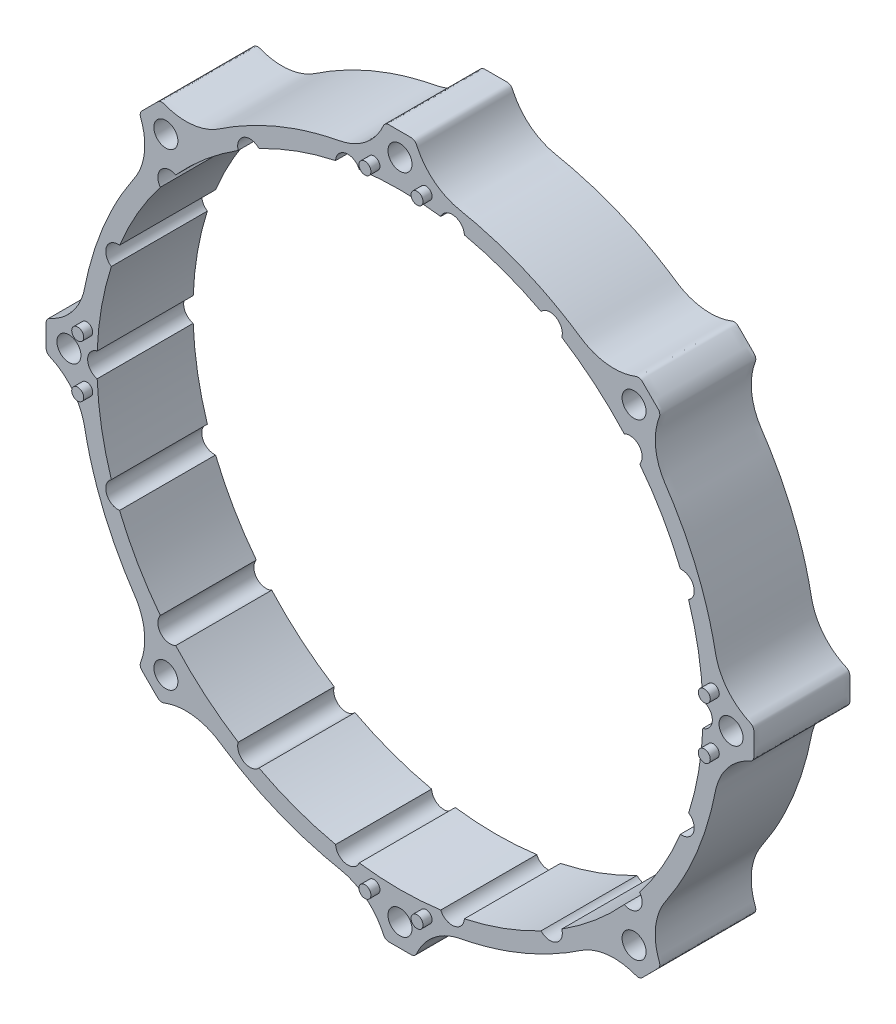
from build123d import *

# Parameters (mm, degrees)
BOSS_EXTRUDE1_DEPTH             = 16
F_4_0MM_DOWEL_HOLE1_D           = 4
F_4_0MM_DOWEL_HOLE1_CSINK_D     = 4.05
F_4_0MM_DOWEL_HOLE1_CSINK_ANGLE = 90
CIRPATTERN1_COUNT               = 8
F_2_0MM_DOWEL_HOLE1_AT_2_COUNT  = 2
F_2_0MM_DOWEL_HOLE1_AT_2_PITCH  = 8.682408883
CIRPATTERN2_COUNT               = 4
SKETCH9_R                       = 1
BOSS_EXTRUDE2_DEPTH             = 1.5
CIRPATTERN3_COUNT               = 4


with BuildPart() as part:
    # Sketch1 → Boss-Extrude1 (new body)
    with BuildSketch(Plane.XY):
        with BuildLine():
            add(Edge.make_bspline(
                [(2.888569338, 58.090305414), (2.86043616, 58.149718786), (2.805341513, 58.269100351), (2.727304111, 58.453248868), (2.652227716, 58.561956296), (2.609742987, 58.612120747), (2.483296792, 58.761423899), (2.319504695, 58.868438946), (2.131986062, 58.924267553), (2.101278346, 58.933409946), (2.038984153, 58.948743127), (1.942760285, 58.965842714), (1.878680735, 58.965842714), (1.84664096, 58.965842714), (1.814601185, 58.965842714), (1.750521635, 58.965842714), (1.654402311, 58.965842714), (1.590322761, 58.965842714), (1.558282986, 58.965842714), (0.519427662, 58.965842714), (-0.519427662, 58.965842714), (-1.558282986, 58.965842714), (-1.590322761, 58.965842714), (-1.654402311, 58.965842714), (-1.750521635, 58.965842714), (-1.814601185, 58.965842714), (-1.84664096, 58.965842714), (-1.878680735, 58.965842714), (-1.942760285, 58.965842714), (-2.038984153, 58.948743127), (-2.101278346, 58.933409946), (-2.131986062, 58.924267553), (-2.319504695, 58.868438946), (-2.483296792, 58.761423899), (-2.609742987, 58.612120747), (-2.652227716, 58.561956296), (-2.727304111, 58.453248868), (-2.805341513, 58.269100351), (-2.86043616, 58.149718786), (-2.888569338, 58.090305414), (-3.904277799, 55.9452699), (-5.591838924, 54.27644442), (-7.748079959, 53.284746062), (-8.235225684, 53.060698004), (-9.245557382, 52.690963884), (-10.84227328, 52.398071486), (-11.889156148, 52.164983222), (-12.410727624, 52.040597997), (-17.936005436, 50.722920633), (-23.183850069, 48.549192213), (-28.022550078, 45.573969403), (-28.479310442, 45.293116312), (-29.384386709, 44.717676629), (-30.720541549, 43.79573419), (-31.696395448, 43.342763299), (-32.199285394, 43.156725154), (-34.52028494, 42.298099023), (-36.994919588, 42.319571853), (-39.300669877, 43.218345087), (-39.301071956, 43.218501816), (-39.301876093, 43.218815326), (-39.303082259, 43.219285695), (-39.303886294, 43.219599465), (-39.304288312, 43.21975635), (-39.304689349, 43.219912852), (-39.305491422, 43.220225856), (-39.306694532, 43.220695362), (-39.307496605, 43.221008367), (-39.307897642, 43.221164869), (-39.310303861, 43.222103881), (-39.31271008, 43.223042894), (-39.3151163, 43.223981906), (-39.315517337, 43.224138408), (-39.31631941, 43.224451412), (-39.317522519, 43.224920919), (-39.318324593, 43.225233923), (-39.318725629, 43.225390425), (-39.319128068, 43.225547474), (-39.319932946, 43.225861573), (-39.321141382, 43.226329852), (-39.321947274, 43.226641342), (-39.32235032, 43.226796825), (-39.599832465, 43.333841276), (-39.896638588, 43.314841774), (-40.158207362, 43.173290965), (-40.186385644, 43.158041979), (-40.241276486, 43.124835529), (-40.32140827, 43.068886213), (-40.366719354, 43.023575129), (-40.389374896, 43.000919586), (-40.412030438, 42.978264044), (-40.457341522, 42.93295296), (-40.525308148, 42.864986334), (-40.570619233, 42.81967525), (-40.593274775, 42.797019708), (-41.327856419, 42.062438063), (-42.062438063, 41.327856419), (-42.797019708, 40.593274775), (-42.81967525, 40.570619233), (-42.864986334, 40.525308148), (-42.93295296, 40.457341522), (-42.978264044, 40.412030438), (-43.000919586, 40.389374896), (-43.023575129, 40.366719354), (-43.068886213, 40.32140827), (-43.124835529, 40.241276486), (-43.158041979, 40.186385644), (-43.173290965, 40.158207362), (-43.314841774, 39.896638588), (-43.333841276, 39.599832465), (-43.226796825, 39.32235032), (-43.226641342, 39.321947274), (-43.226329852, 39.321141382), (-43.225861573, 39.319932946), (-43.225547474, 39.319128068), (-43.225390425, 39.318725629), (-43.225233923, 39.318324593), (-43.224920919, 39.317522519), (-43.224451412, 39.31631941), (-43.224138408, 39.315517337), (-43.223981906, 39.3151163), (-43.223042894, 39.31271008), (-43.222103881, 39.310303861), (-43.221164869, 39.307897642), (-43.221008367, 39.307496605), (-43.220695362, 39.306694532), (-43.220225856, 39.305491422), (-43.219912852, 39.304689349), (-43.21975635, 39.304288312), (-43.219599465, 39.303886294), (-43.219285695, 39.303082259), (-43.218815326, 39.301876093), (-43.218501816, 39.301071956), (-43.218345087, 39.300669877), (-42.319571853, 36.994919588), (-42.298099023, 34.52028494), (-43.156725154, 32.199285394), (-43.342763299, 31.696395448), (-43.79573419, 30.720541549), (-44.717676629, 29.384386709), (-45.293116312, 28.479310442), (-45.573969403, 28.022550078), (-48.549192213, 23.183850069), (-50.722920633, 17.936005436), (-52.040597997, 12.410727624), (-52.164983222, 11.889156148), (-52.398071486, 10.84227328), (-52.690963884, 9.245557382), (-53.060698004, 8.235225684), (-53.284746062, 7.748079959), (-54.31880022, 5.499745081), (-56.083814744, 3.765097724), (-58.349755058, 2.770214708), (-58.350150195, 2.770041219), (-58.350940491, 2.769694293), (-58.35212598, 2.769174006), (-58.352916388, 2.768827336), (-58.353311592, 2.768654001), (-58.353705831, 2.768481089), (-58.35449431, 2.768135265), (-58.355677028, 2.767616529), (-58.356465507, 2.767270705), (-58.356859746, 2.767097793), (-58.359225182, 2.766060321), (-58.361590618, 2.765022849), (-58.363956055, 2.763985377), (-58.364350294, 2.763812465), (-58.365138773, 2.763466641), (-58.366321491, 2.762947905), (-58.367109969, 2.762602081), (-58.367504209, 2.762429169), (-58.367899827, 2.762255652), (-58.368691063, 2.761908619), (-58.36987668, 2.761385249), (-58.370666787, 2.761035654), (-58.371061728, 2.7608606), (-58.642963091, 2.640342951), (-58.839402036, 2.417034653), (-58.924267553, 2.131986062), (-58.933409946, 2.101278346), (-58.948743127, 2.038984153), (-58.965842714, 1.942760285), (-58.965842714, 1.878680735), (-58.965842714, 1.84664096), (-58.965842714, 1.814601185), (-58.965842714, 1.750521635), (-58.965842714, 1.654402311), (-58.965842714, 1.590322761), (-58.965842714, 1.558282986), (-58.965842714, 0.519427662), (-58.965842714, -0.519427662), (-58.965842714, -1.558282986), (-58.965842714, -1.590322761), (-58.965842714, -1.654402311), (-58.965842714, -1.750521635), (-58.965842714, -1.814601185), (-58.965842714, -1.84664096), (-58.965842714, -1.878680735), (-58.965842714, -1.942760285), (-58.948743127, -2.038984153), (-58.933409946, -2.101278346), (-58.924267553, -2.131986062), (-58.839402036, -2.417034653), (-58.642963091, -2.640342951), (-58.371061728, -2.7608606), (-58.370666787, -2.761035654), (-58.36987668, -2.761385249), (-58.368691063, -2.761908619), (-58.367899827, -2.762255652), (-58.367504209, -2.762429169), (-58.367109969, -2.762602081), (-58.366321491, -2.762947905), (-58.365138773, -2.763466641), (-58.364350294, -2.763812465), (-58.363956055, -2.763985377), (-58.361590618, -2.765022849), (-58.359225182, -2.766060321), (-58.356859746, -2.767097793), (-58.356465507, -2.767270705), (-58.355677028, -2.767616529), (-58.35449431, -2.768135265), (-58.353705831, -2.768481089), (-58.353311592, -2.768654001), (-58.352916388, -2.768827336), (-58.35212598, -2.769174006), (-58.350940491, -2.769694293), (-58.350150195, -2.770041219), (-58.349755058, -2.770214708), (-56.083814744, -3.765097724), (-54.31880022, -5.499745081), (-53.284746062, -7.748079959), (-53.060698004, -8.235225684), (-52.690963884, -9.245557382), (-52.398071486, -10.84227328), (-52.164983222, -11.889156148), (-52.040597997, -12.410727624), (-50.722920633, -17.936005436), (-48.549192213, -23.183850069), (-45.573969403, -28.022550078), (-45.293116312, -28.479310442), (-44.717676629, -29.384386709), (-43.79573419, -30.720541549), (-43.342763299, -31.696395448), (-43.156725154, -32.199285394), (-42.298099023, -34.52028494), (-42.319571853, -36.994919588), (-43.218345087, -39.300669877), (-43.218501816, -39.301071956), (-43.218815326, -39.301876093), (-43.219285695, -39.303082259), (-43.219599465, -39.303886294), (-43.21975635, -39.304288312), (-43.219912852, -39.304689349), (-43.220225856, -39.305491422), (-43.220695362, -39.306694532), (-43.221008367, -39.307496605), (-43.221164869, -39.307897642), (-43.222103881, -39.310303861), (-43.223042894, -39.31271008), (-43.223981906, -39.3151163), (-43.224138408, -39.315517337), (-43.224451412, -39.31631941), (-43.224920919, -39.317522519), (-43.225233923, -39.318324593), (-43.225390425, -39.318725629), (-43.225547474, -39.319128068), (-43.225861573, -39.319932946), (-43.226329852, -39.321141382), (-43.226641342, -39.321947274), (-43.226796825, -39.32235032), (-43.333841276, -39.599832465), (-43.314841774, -39.896638588), (-43.173290965, -40.158207362), (-43.158041979, -40.186385644), (-43.124835529, -40.241276486), (-43.068886213, -40.32140827), (-43.023575129, -40.366719354), (-43.000919586, -40.389374896), (-42.978264044, -40.412030438), (-42.93295296, -40.457341522), (-42.864986334, -40.525308148), (-42.81967525, -40.570619233), (-42.797019708, -40.593274775), (-42.062438063, -41.327856419), (-41.327856419, -42.062438063), (-40.593274775, -42.797019708), (-40.570619233, -42.81967525), (-40.525308148, -42.864986334), (-40.457341522, -42.93295296), (-40.412030438, -42.978264044), (-40.389374896, -43.000919586), (-40.366719354, -43.023575129), (-40.32140827, -43.068886213), (-40.241276486, -43.124835529), (-40.186385644, -43.158041979), (-40.158207362, -43.173290965), (-39.896638588, -43.314841774), (-39.599832465, -43.333841276), (-39.32235032, -43.226796825), (-39.321947274, -43.226641342), (-39.321141382, -43.226329852), (-39.319932946, -43.225861573), (-39.319128068, -43.225547474), (-39.318725629, -43.225390425), (-39.318324593, -43.225233923), (-39.317522519, -43.224920919), (-39.31631941, -43.224451412), (-39.315517337, -43.224138408), (-39.3151163, -43.223981906), (-39.31271008, -43.223042894), (-39.310303861, -43.222103881), (-39.307897642, -43.221164869), (-39.307496605, -43.221008367), (-39.306694532, -43.220695362), (-39.305491422, -43.220225856), (-39.304689349, -43.219912852), (-39.304288312, -43.21975635), (-39.303886294, -43.219599465), (-39.303082259, -43.219285695), (-39.301876093, -43.218815326), (-39.301071956, -43.218501816), (-39.300669877, -43.218345087), (-36.994919588, -42.319571853), (-34.52028494, -42.298099023), (-32.199285394, -43.156725154), (-31.696395448, -43.342763299), (-30.720541549, -43.79573419), (-29.384386709, -44.717676629), (-28.479310442, -45.293116312), (-28.022550078, -45.573969403), (-23.183850069, -48.549192213), (-17.936005436, -50.722920633), (-12.410727624, -52.040597997), (-11.889156148, -52.164983222), (-10.84227328, -52.398071486), (-9.245557382, -52.690963884), (-8.235225684, -53.060698004), (-7.748079959, -53.284746062), (-5.499745081, -54.31880022), (-3.765097724, -56.083814744), (-2.770214708, -58.349755058), (-2.770041219, -58.350150195), (-2.769694293, -58.350940491), (-2.769174006, -58.35212598), (-2.768827336, -58.352916388), (-2.768654001, -58.353311592), (-2.768481089, -58.353705831), (-2.768135265, -58.35449431), (-2.767616529, -58.355677028), (-2.767270705, -58.356465507), (-2.767097793, -58.356859746), (-2.766060321, -58.359225182), (-2.765022849, -58.361590618), (-2.763985377, -58.363956055), (-2.763812465, -58.364350294), (-2.763466641, -58.365138773), (-2.762947905, -58.366321491), (-2.762602081, -58.367109969), (-2.762429169, -58.367504209), (-2.762255652, -58.367899827), (-2.761908619, -58.368691063), (-2.761385249, -58.36987668), (-2.761035654, -58.370666787), (-2.7608606, -58.371061728), (-2.640342951, -58.642963091), (-2.417034653, -58.839402036), (-2.131986062, -58.924267553), (-2.101278346, -58.933409946), (-2.038984153, -58.948743127), (-1.942760285, -58.965842714), (-1.878680735, -58.965842714), (-1.84664096, -58.965842714), (-1.814601185, -58.965842714), (-1.750521635, -58.965842714), (-1.654402311, -58.965842714), (-1.590322761, -58.965842714), (-1.558282986, -58.965842714), (-0.519427662, -58.965842714), (0.519427662, -58.965842714), (1.558282986, -58.965842714), (1.590322761, -58.965842714), (1.654402311, -58.965842714), (1.750521635, -58.965842714), (1.814601185, -58.965842714), (1.84664096, -58.965842714), (1.878680735, -58.965842714), (1.942760285, -58.965842714), (2.038984153, -58.948743127), (2.101278346, -58.933409946), (2.131986062, -58.924267553), (2.417034653, -58.839402036), (2.640342951, -58.642963091), (2.7608606, -58.371061728), (2.761035654, -58.370666787), (2.761385249, -58.36987668), (2.761908619, -58.368691063), (2.762255652, -58.367899827), (2.762429169, -58.367504209), (2.762602081, -58.367109969), (2.762947905, -58.366321491), (2.763466641, -58.365138773), (2.763812465, -58.364350294), (2.763985377, -58.363956055), (2.765022849, -58.361590618), (2.766060321, -58.359225182), (2.767097793, -58.356859746), (2.767270705, -58.356465507), (2.767616529, -58.355677028), (2.768135265, -58.35449431), (2.768481089, -58.353705831), (2.768654001, -58.353311592), (2.768827336, -58.352916388), (2.769174006, -58.35212598), (2.769694293, -58.350940491), (2.770041219, -58.350150195), (2.770214708, -58.349755058), (3.765097724, -56.083814744), (5.499745081, -54.31880022), (7.748079959, -53.284746062), (8.235225684, -53.060698004), (9.245557382, -52.690963884), (10.84227328, -52.398071486), (11.889156148, -52.164983222), (12.410727624, -52.040597997), (17.936005436, -50.722920633), (23.183850069, -48.549192213), (28.022550078, -45.573969403), (28.479310442, -45.293116312), (29.384386709, -44.717676629), (30.720541549, -43.79573419), (31.696395448, -43.342763299), (32.199285394, -43.156725154), (34.52028494, -42.298099023), (36.994919588, -42.319571853), (39.300669877, -43.218345087), (39.301071956, -43.218501816), (39.301876093, -43.218815326), (39.303082259, -43.219285695), (39.303886294, -43.219599465), (39.304288312, -43.21975635), (39.304689349, -43.219912852), (39.305491422, -43.220225856), (39.306694532, -43.220695362), (39.307496605, -43.221008367), (39.307897642, -43.221164869), (39.310303861, -43.222103881), (39.31271008, -43.223042894), (39.3151163, -43.223981906), (39.315517337, -43.224138408), (39.31631941, -43.224451412), (39.317522519, -43.224920919), (39.318324593, -43.225233923), (39.318725629, -43.225390425), (39.319128068, -43.225547474), (39.319932946, -43.225861573), (39.321141382, -43.226329852), (39.321947274, -43.226641342), (39.32235032, -43.226796825), (39.599832465, -43.333841276), (39.896638588, -43.314841774), (40.158207362, -43.173290965), (40.186385644, -43.158041979), (40.241276486, -43.124835529), (40.32140827, -43.068886213), (40.366719354, -43.023575129), (40.389374896, -43.000919586), (40.412030438, -42.978264044), (40.457341522, -42.93295296), (40.525308148, -42.864986334), (40.570619233, -42.81967525), (40.593274775, -42.797019708), (41.327856419, -42.062438063), (42.062438063, -41.327856419), (42.797019708, -40.593274775), (42.81967525, -40.570619233), (42.864986334, -40.525308148), (42.93295296, -40.457341522), (42.978264044, -40.412030438), (43.000919586, -40.389374896), (43.023575129, -40.366719354), (43.068886213, -40.32140827), (43.124835529, -40.241276486), (43.158041979, -40.186385644), (43.173290965, -40.158207362), (43.314841774, -39.896638588), (43.333841276, -39.599832465), (43.226796825, -39.32235032), (43.226641342, -39.321947274), (43.226329852, -39.321141382), (43.225861573, -39.319932946), (43.225547474, -39.319128068), (43.225390425, -39.318725629), (43.225233923, -39.318324593), (43.224920919, -39.317522519), (43.224451412, -39.31631941), (43.224138408, -39.315517337), (43.223981906, -39.3151163), (43.223042894, -39.31271008), (43.222103881, -39.310303861), (43.221164869, -39.307897642), (43.221008367, -39.307496605), (43.220695362, -39.306694532), (43.220225856, -39.305491422), (43.219912852, -39.304689349), (43.21975635, -39.304288312), (43.219599465, -39.303886294), (43.219285695, -39.303082259), (43.218815326, -39.301876093), (43.218501816, -39.301071956), (43.218345087, -39.300669877), (42.319571853, -36.994919588), (42.298099023, -34.52028494), (43.156725154, -32.199285394), (43.342763299, -31.696395448), (43.79573419, -30.720541549), (44.717676629, -29.384386709), (45.293116312, -28.479310442), (45.573969403, -28.022550078), (48.549192213, -23.183850069), (50.722920633, -17.936005436), (52.040597997, -12.410727624), (52.164983222, -11.889156148), (52.398071486, -10.84227328), (52.690963884, -9.245557382), (53.060698004, -8.235225684), (53.284746062, -7.748079959), (54.31880022, -5.499745081), (56.083814744, -3.765097724), (58.349755058, -2.770214708), (58.350150195, -2.770041219), (58.350940491, -2.769694293), (58.35212598, -2.769174006), (58.352916388, -2.768827336), (58.353311592, -2.768654001), (58.353705831, -2.768481089), (58.35449431, -2.768135265), (58.355677028, -2.767616529), (58.356465507, -2.767270705), (58.356859746, -2.767097793), (58.359225182, -2.766060321), (58.361590618, -2.765022849), (58.363956055, -2.763985377), (58.364350294, -2.763812465), (58.365138773, -2.763466641), (58.366321491, -2.762947905), (58.367109969, -2.762602081), (58.367504209, -2.762429169), (58.367899827, -2.762255652), (58.368691063, -2.761908619), (58.36987668, -2.761385249), (58.370666787, -2.761035654), (58.371061728, -2.7608606), (58.642963091, -2.640342951), (58.839402036, -2.417034653), (58.924267553, -2.131986062), (58.933409946, -2.101278346), (58.948743127, -2.038984153), (58.965842714, -1.942760285), (58.965842714, -1.878680735), (58.965842714, -1.84664096), (58.965842714, -1.814601185), (58.965842714, -1.750521635), (58.965842714, -1.654402311), (58.965842714, -1.590322761), (58.965842714, -1.558282986), (58.965842714, -0.519427662), (58.965842714, 0.519427662), (58.965842714, 1.558282986), (58.965842714, 1.590322761), (58.965842714, 1.654402311), (58.965842714, 1.750521635), (58.965842714, 1.814601185), (58.965842714, 1.84664096), (58.965842714, 1.878680735), (58.965842714, 1.942760285), (58.948743127, 2.038984153), (58.933409946, 2.101278346), (58.924267553, 2.131986062), (58.839402036, 2.417034653), (58.642963091, 2.640342951), (58.371061728, 2.7608606), (58.370666787, 2.761035654), (58.36987668, 2.761385249), (58.368691063, 2.761908619), (58.367899827, 2.762255652), (58.367504209, 2.762429169), (58.367109969, 2.762602081), (58.366321491, 2.762947905), (58.365138773, 2.763466641), (58.364350294, 2.763812465), (58.363956055, 2.763985377), (58.361590618, 2.765022849), (58.359225182, 2.766060321), (58.356859746, 2.767097793), (58.356465507, 2.767270705), (58.355677028, 2.767616529), (58.35449431, 2.768135265), (58.353705831, 2.768481089), (58.353311592, 2.768654001), (58.352916388, 2.768827336), (58.35212598, 2.769174006), (58.350940491, 2.769694293), (58.350150195, 2.770041219), (58.349755058, 2.770214708), (56.083814744, 3.765097724), (54.31880022, 5.499745081), (53.284746062, 7.748079959), (53.060698004, 8.235225684), (52.690963884, 9.245557382), (52.398071486, 10.84227328), (52.164983222, 11.889156148), (52.040597997, 12.410727624), (50.722920633, 17.936005436), (48.549192213, 23.183850069), (45.573969403, 28.022550078), (45.293116312, 28.479310442), (44.717676629, 29.384386709), (43.79573419, 30.720541549), (43.342763299, 31.696395448), (43.156725154, 32.199285394), (42.298099023, 34.52028494), (42.319571853, 36.994919588), (43.218345087, 39.300669877), (43.218501816, 39.301071956), (43.218815326, 39.301876093), (43.219285695, 39.303082259), (43.219599465, 39.303886294), (43.21975635, 39.304288312), (43.219912852, 39.304689349), (43.220225856, 39.305491422), (43.220695362, 39.306694532), (43.221008367, 39.307496605), (43.221164869, 39.307897642), (43.222103881, 39.310303861), (43.223042894, 39.31271008), (43.223981906, 39.3151163), (43.224138408, 39.315517337), (43.224451412, 39.31631941), (43.224920919, 39.317522519), (43.225233923, 39.318324593), (43.225390425, 39.318725629), (43.225547474, 39.319128068), (43.225861573, 39.319932946), (43.226329852, 39.321141382), (43.226641342, 39.321947274), (43.226796825, 39.32235032), (43.333841276, 39.599832465), (43.314841774, 39.896638588), (43.173290965, 40.158207362), (43.158041979, 40.186385644), (43.124835529, 40.241276486), (43.068886213, 40.32140827), (43.023575129, 40.366719354), (43.000919586, 40.389374896), (42.978264044, 40.412030438), (42.93295296, 40.457341522), (42.864986334, 40.525308148), (42.81967525, 40.570619233), (42.797019708, 40.593274775), (42.062438063, 41.327856419), (41.327856419, 42.062438063), (40.593274775, 42.797019708), (40.570619233, 42.81967525), (40.525308148, 42.864986334), (40.457341522, 42.93295296), (40.412030438, 42.978264044), (40.389374896, 43.000919586), (40.366719354, 43.023575129), (40.32140827, 43.068886213), (40.241276486, 43.124835529), (40.186385644, 43.158041979), (40.158207362, 43.173290965), (39.896638588, 43.314841774), (39.599832465, 43.333841276), (39.32235032, 43.226796825), (39.321947274, 43.226641342), (39.321141382, 43.226329852), (39.319932946, 43.225861573), (39.319128068, 43.225547474), (39.318725629, 43.225390425), (39.318324593, 43.225233923), (39.317522519, 43.224920919), (39.31631941, 43.224451412), (39.315517337, 43.224138408), (39.3151163, 43.223981906), (39.31271008, 43.223042894), (39.310303861, 43.222103881), (39.307897642, 43.221164869), (39.307496605, 43.221008367), (39.306694532, 43.220695362), (39.305491422, 43.220225856), (39.304689349, 43.219912852), (39.304288312, 43.21975635), (39.303886295, 43.219599465), (39.303082259, 43.219285695), (39.301876093, 43.218815326), (39.301071956, 43.218501816), (39.300669877, 43.218345087), (36.994919588, 42.319571853), (34.52028494, 42.298099023), (32.199285394, 43.156725154), (31.696395448, 43.342763299), (30.720541549, 43.79573419), (29.384386709, 44.717676629), (28.479310442, 45.293116312), (28.022550078, 45.573969403), (23.183850069, 48.549192213), (17.936005436, 50.722920633), (12.410727624, 52.040597997), (11.889156148, 52.164983222), (10.84227328, 52.398071486), (9.245557382, 52.690963884), (8.235225684, 53.060698004), (7.748079959, 53.284746062), (5.591838924, 54.27644442), (3.904277799, 55.9452699), (2.888569338, 58.090305414)],
                knots=[0, 0, 0, 0, 0.00052727, 0.001054541, 0.001581811, 0.001581811, 0.001581811, 0.003107616, 0.003107616, 0.003107616, 0.003364602, 0.003621588, 0.003878574, 0.003878574, 0.003878574, 0.00413556, 0.004392546, 0.004649532, 0.004649532, 0.004649532, 0.012982025, 0.012982025, 0.012982025, 0.013239011, 0.013495997, 0.013752983, 0.013752983, 0.013752983, 0.014009968, 0.014266954, 0.01452394, 0.01452394, 0.01452394, 0.016049745, 0.016049745, 0.016049745, 0.016577016, 0.017104286, 0.017631556, 0.017631556, 0.017631556, 0.035903949, 0.035903949, 0.035903949, 0.040204709, 0.044505469, 0.048806229, 0.048806229, 0.048806229, 0.093985258, 0.093985258, 0.093985258, 0.098286018, 0.102586778, 0.106887539, 0.106887539, 0.106887539, 0.125874611, 0.125874611, 0.125874611, 0.125878073, 0.125881534, 0.125884995, 0.125884995, 0.125884995, 0.125888448, 0.125891901, 0.125895354, 0.125895354, 0.125895354, 0.125916072, 0.125916072, 0.125916072, 0.125919524, 0.125922977, 0.12592643, 0.12592643, 0.12592643, 0.125929895, 0.12593336, 0.125936825, 0.125936825, 0.125936825, 0.128176158, 0.128176158, 0.128176158, 0.128433144, 0.12869013, 0.128947116, 0.128947116, 0.128947116, 0.129204102, 0.129461088, 0.129718073, 0.129718073, 0.129718073, 0.138050566, 0.138050566, 0.138050566, 0.138307552, 0.138564538, 0.138821524, 0.138821524, 0.138821524, 0.13907851, 0.139335496, 0.139592482, 0.139592482, 0.139592482, 0.141831815, 0.141831815, 0.141831815, 0.14183528, 0.141838745, 0.14184221, 0.14184221, 0.14184221, 0.141845663, 0.141849116, 0.141852568, 0.141852568, 0.141852568, 0.141873286, 0.141873286, 0.141873286, 0.141876739, 0.141880192, 0.141883645, 0.141883645, 0.141883645, 0.141887106, 0.141890567, 0.141894029, 0.141894029, 0.141894029, 0.160881101, 0.160881101, 0.160881101, 0.165181861, 0.169482622, 0.173783382, 0.173783382, 0.173783382, 0.218962411, 0.218962411, 0.218962411, 0.223263171, 0.227563931, 0.231864691, 0.231864691, 0.231864691, 0.250851764, 0.250851764, 0.250851764, 0.250855225, 0.250858687, 0.250862148, 0.250862148, 0.250862148, 0.250865601, 0.250869054, 0.250872507, 0.250872507, 0.250872507, 0.250893224, 0.250893224, 0.250893224, 0.250896677, 0.25090013, 0.250903583, 0.250903583, 0.250903583, 0.250907048, 0.250910513, 0.250913978, 0.250913978, 0.250913978, 0.253153311, 0.253153311, 0.253153311, 0.253410297, 0.253667282, 0.253924268, 0.253924268, 0.253924268, 0.254181254, 0.25443824, 0.254695226, 0.254695226, 0.254695226, 0.263027719, 0.263027719, 0.263027719, 0.263284705, 0.263541691, 0.263798677, 0.263798677, 0.263798677, 0.264055663, 0.264312649, 0.264569635, 0.264569635, 0.264569635, 0.266808968, 0.266808968, 0.266808968, 0.266812433, 0.266815897, 0.266819362, 0.266819362, 0.266819362, 0.266822815, 0.266826268, 0.266829721, 0.266829721, 0.266829721, 0.266850439, 0.266850439, 0.266850439, 0.266853892, 0.266857344, 0.266860797, 0.266860797, 0.266860797, 0.266864259, 0.26686772, 0.266871181, 0.266871181, 0.266871181, 0.285858254, 0.285858254, 0.285858254, 0.290159014, 0.294459774, 0.298760535, 0.298760535, 0.298760535, 0.343939564, 0.343939564, 0.343939564, 0.348240324, 0.352541084, 0.356841844, 0.356841844, 0.356841844, 0.375828917, 0.375828917, 0.375828917, 0.375832378, 0.375835839, 0.375839301, 0.375839301, 0.375839301, 0.375842754, 0.375846207, 0.37584966, 0.37584966, 0.37584966, 0.375870377, 0.375870377, 0.375870377, 0.37587383, 0.375877283, 0.375880736, 0.375880736, 0.375880736, 0.375884201, 0.375887666, 0.375891131, 0.375891131, 0.375891131, 0.378130463, 0.378130463, 0.378130463, 0.378387449, 0.378644435, 0.378901421, 0.378901421, 0.378901421, 0.379158407, 0.379415393, 0.379672379, 0.379672379, 0.379672379, 0.388004872, 0.388004872, 0.388004872, 0.388261858, 0.388518844, 0.38877583, 0.38877583, 0.38877583, 0.389032816, 0.389289802, 0.389546788, 0.389546788, 0.389546788, 0.39178612, 0.39178612, 0.39178612, 0.391789585, 0.39179305, 0.391796515, 0.391796515, 0.391796515, 0.391799968, 0.391803421, 0.391806874, 0.391806874, 0.391806874, 0.391827591, 0.391827591, 0.391827591, 0.391831044, 0.391834497, 0.39183795, 0.39183795, 0.39183795, 0.391841411, 0.391844873, 0.391848334, 0.391848334, 0.391848334, 0.410835407, 0.410835407, 0.410835407, 0.415136167, 0.419436927, 0.423737687, 0.423737687, 0.423737687, 0.468916716, 0.468916716, 0.468916716, 0.473217477, 0.477518237, 0.481818997, 0.481818997, 0.481818997, 0.50080607, 0.50080607, 0.50080607, 0.500809531, 0.500812992, 0.500816454, 0.500816454, 0.500816454, 0.500819906, 0.500823359, 0.500826812, 0.500826812, 0.500826812, 0.50084753, 0.50084753, 0.50084753, 0.500850983, 0.500854436, 0.500857888, 0.500857888, 0.500857888, 0.500861353, 0.500864818, 0.500868283, 0.500868283, 0.500868283, 0.503107616, 0.503107616, 0.503107616, 0.503364602, 0.503621588, 0.503878574, 0.503878574, 0.503878574, 0.50413556, 0.504392546, 0.504649532, 0.504649532, 0.504649532, 0.512982025, 0.512982025, 0.512982025, 0.513239011, 0.513495997, 0.513752983, 0.513752983, 0.513752983, 0.514009968, 0.514266954, 0.51452394, 0.51452394, 0.51452394, 0.516763273, 0.516763273, 0.516763273, 0.516766738, 0.516770203, 0.516773668, 0.516773668, 0.516773668, 0.516777121, 0.516780574, 0.516784027, 0.516784027, 0.516784027, 0.516804744, 0.516804744, 0.516804744, 0.516808197, 0.51681165, 0.516815103, 0.516815103, 0.516815103, 0.516818564, 0.516822026, 0.516825487, 0.516825487, 0.516825487, 0.53581256, 0.53581256, 0.53581256, 0.54011332, 0.54441408, 0.54871484, 0.54871484, 0.54871484, 0.593893869, 0.593893869, 0.593893869, 0.598194629, 0.602495389, 0.60679615, 0.60679615, 0.60679615, 0.625783222, 0.625783222, 0.625783222, 0.625786684, 0.625790145, 0.625793606, 0.625793606, 0.625793606, 0.625797059, 0.625800512, 0.625803965, 0.625803965, 0.625803965, 0.625824682, 0.625824682, 0.625824682, 0.625828135, 0.625831588, 0.625835041, 0.625835041, 0.625835041, 0.625838506, 0.625841971, 0.625845436, 0.625845436, 0.625845436, 0.628084769, 0.628084769, 0.628084769, 0.628341755, 0.628598741, 0.628855727, 0.628855727, 0.628855727, 0.629112713, 0.629369699, 0.629626684, 0.629626684, 0.629626684, 0.637959177, 0.637959177, 0.637959177, 0.638216163, 0.638473149, 0.638730135, 0.638730135, 0.638730135, 0.638987121, 0.639244107, 0.639501093, 0.639501093, 0.639501093, 0.641740426, 0.641740426, 0.641740426, 0.641743891, 0.641747356, 0.641750821, 0.641750821, 0.641750821, 0.641754274, 0.641757727, 0.641761179, 0.641761179, 0.641761179, 0.641781897, 0.641781897, 0.641781897, 0.64178535, 0.641788803, 0.641792256, 0.641792256, 0.641792256, 0.641795717, 0.641799178, 0.64180264, 0.64180264, 0.64180264, 0.660789712, 0.660789712, 0.660789712, 0.665090472, 0.669391233, 0.673691993, 0.673691993, 0.673691993, 0.718871022, 0.718871022, 0.718871022, 0.723171782, 0.727472542, 0.731773302, 0.731773302, 0.731773302, 0.750760375, 0.750760375, 0.750760375, 0.750763836, 0.750767298, 0.750770759, 0.750770759, 0.750770759, 0.750774212, 0.750777665, 0.750781118, 0.750781118, 0.750781118, 0.750801835, 0.750801835, 0.750801835, 0.750805288, 0.750808741, 0.750812194, 0.750812194, 0.750812194, 0.750815659, 0.750819124, 0.750822589, 0.750822589, 0.750822589, 0.753061922, 0.753061922, 0.753061922, 0.753318908, 0.753575893, 0.753832879, 0.753832879, 0.753832879, 0.754089865, 0.754346851, 0.754603837, 0.754603837, 0.754603837, 0.76293633, 0.76293633, 0.76293633, 0.763193316, 0.763450302, 0.763707288, 0.763707288, 0.763707288, 0.763964274, 0.76422126, 0.764478246, 0.764478246, 0.764478246, 0.766717579, 0.766717579, 0.766717579, 0.766721043, 0.766724508, 0.766727973, 0.766727973, 0.766727973, 0.766731426, 0.766734879, 0.766738332, 0.766738332, 0.766738332, 0.76675905, 0.76675905, 0.76675905, 0.766762503, 0.766765955, 0.766769408, 0.766769408, 0.766769408, 0.76677287, 0.766776331, 0.766779792, 0.766779792, 0.766779792, 0.785766865, 0.785766865, 0.785766865, 0.790067625, 0.794368385, 0.798669146, 0.798669146, 0.798669146, 0.843848175, 0.843848175, 0.843848175, 0.848148935, 0.852449695, 0.856750455, 0.856750455, 0.856750455, 0.875737528, 0.875737528, 0.875737528, 0.875740989, 0.87574445, 0.875747912, 0.875747912, 0.875747912, 0.875751365, 0.875754818, 0.875758271, 0.875758271, 0.875758271, 0.875778988, 0.875778988, 0.875778988, 0.875782441, 0.875785894, 0.875789347, 0.875789347, 0.875789347, 0.875792812, 0.875796277, 0.875799742, 0.875799742, 0.875799742, 0.878039074, 0.878039074, 0.878039074, 0.87829606, 0.878553046, 0.878810032, 0.878810032, 0.878810032, 0.879067018, 0.879324004, 0.87958099, 0.87958099, 0.87958099, 0.887913483, 0.887913483, 0.887913483, 0.888170469, 0.888427455, 0.888684441, 0.888684441, 0.888684441, 0.888941427, 0.889198413, 0.889455399, 0.889455399, 0.889455399, 0.891694731, 0.891694731, 0.891694731, 0.891698196, 0.891701661, 0.891705126, 0.891705126, 0.891705126, 0.891708579, 0.891712032, 0.891715485, 0.891715485, 0.891715485, 0.891736202, 0.891736202, 0.891736202, 0.891739655, 0.891743108, 0.891746561, 0.891746561, 0.891746561, 0.891750022, 0.891753484, 0.891756945, 0.891756945, 0.891756945, 0.910744018, 0.910744018, 0.910744018, 0.915044778, 0.919345538, 0.923646298, 0.923646298, 0.923646298, 0.968825327, 0.968825327, 0.968825327, 0.973126088, 0.977426848, 0.981727608, 0.981727608, 0.981727608, 1, 1, 1, 1], degree=3, weights=[1, 1, 1, 1, 1, 1, 0.972283226, 0.972283226, 1, 1, 1, 1, 1, 1, 1, 1, 1, 1, 1, 1, 1, 1, 1, 1, 1, 1, 1, 1, 1, 1, 1, 1, 0.972283226, 0.972283226, 1, 1, 1, 1, 1, 1, 0.959868564, 0.959868564, 1, 1, 1, 1, 1, 1, 0.991633934, 0.991633934, 1, 1, 1, 1, 1, 1, 0.956556623, 0.956556623, 1, 1, 1, 1, 1, 1, 1, 1, 1, 1, 1, 1, 1, 1, 1, 1, 1, 1, 1, 1, 1, 1, 1, 1, 0.938723945, 0.938723945, 1, 1, 1, 1, 1, 1, 1, 1, 1, 1, 1, 1, 1, 1, 1, 1, 1, 1, 1, 1, 1, 1, 1, 1, 0.938723945, 0.938723945, 1, 1, 1, 1, 1, 1, 1, 1, 1, 1, 1, 1, 1, 1, 1, 1, 1, 1, 1, 1, 1, 1, 1, 1, 0.956556623, 0.956556623, 1, 1, 1, 1, 1, 1, 0.991633934, 0.991633934, 1, 1, 1, 1, 1, 1, 0.956556623, 0.956556623, 1, 1, 1, 1, 1, 1, 1, 1, 1, 1, 1, 1, 1, 1, 1, 1, 1, 1, 1, 1, 1, 1, 1, 1, 0.938723945, 0.938723945, 1, 1, 1, 1, 1, 1, 1, 1, 1, 1, 1, 1, 1, 1, 1, 1, 1, 1, 1, 1, 1, 1, 1, 1, 0.938723945, 0.938723945, 1, 1, 1, 1, 1, 1, 1, 1, 1, 1, 1, 1, 1, 1, 1, 1, 1, 1, 1, 1, 1, 1, 1, 1, 0.956556623, 0.956556623, 1, 1, 1, 1, 1, 1, 0.991633934, 0.991633934, 1, 1, 1, 1, 1, 1, 0.956556623, 0.956556623, 1, 1, 1, 1, 1, 1, 1, 1, 1, 1, 1, 1, 1, 1, 1, 1, 1, 1, 1, 1, 1, 1, 1, 1, 0.938723945, 0.938723945, 1, 1, 1, 1, 1, 1, 1, 1, 1, 1, 1, 1, 1, 1, 1, 1, 1, 1, 1, 1, 1, 1, 1, 1, 0.938723945, 0.938723945, 1, 1, 1, 1, 1, 1, 1, 1, 1, 1, 1, 1, 1, 1, 1, 1, 1, 1, 1, 1, 1, 1, 1, 1, 0.956556623, 0.956556623, 1, 1, 1, 1, 1, 1, 0.991633934, 0.991633934, 1, 1, 1, 1, 1, 1, 0.956556623, 0.956556623, 1, 1, 1, 1, 1, 1, 1, 1, 1, 1, 1, 1, 1, 1, 1, 1, 1, 1, 1, 1, 1, 1, 1, 1, 0.938723945, 0.938723945, 1, 1, 1, 1, 1, 1, 1, 1, 1, 1, 1, 1, 1, 1, 1, 1, 1, 1, 1, 1, 1, 1, 1, 1, 0.938723945, 0.938723945, 1, 1, 1, 1, 1, 1, 1, 1, 1, 1, 1, 1, 1, 1, 1, 1, 1, 1, 1, 1, 1, 1, 1, 1, 0.956556623, 0.956556623, 1, 1, 1, 1, 1, 1, 0.991633934, 0.991633934, 1, 1, 1, 1, 1, 1, 0.956556623, 0.956556623, 1, 1, 1, 1, 1, 1, 1, 1, 1, 1, 1, 1, 1, 1, 1, 1, 1, 1, 1, 1, 1, 1, 1, 1, 0.938723945, 0.938723945, 1, 1, 1, 1, 1, 1, 1, 1, 1, 1, 1, 1, 1, 1, 1, 1, 1, 1, 1, 1, 1, 1, 1, 1, 0.938723945, 0.938723945, 1, 1, 1, 1, 1, 1, 1, 1, 1, 1, 1, 1, 1, 1, 1, 1, 1, 1, 1, 1, 1, 1, 1, 1, 0.956556623, 0.956556623, 1, 1, 1, 1, 1, 1, 0.991633934, 0.991633934, 1, 1, 1, 1, 1, 1, 0.956556623, 0.956556623, 1, 1, 1, 1, 1, 1, 1, 1, 1, 1, 1, 1, 1, 1, 1, 1, 1, 1, 1, 1, 1, 1, 1, 1, 0.938723945, 0.938723945, 1, 1, 1, 1, 1, 1, 1, 1, 1, 1, 1, 1, 1, 1, 1, 1, 1, 1, 1, 1, 1, 1, 1, 1, 0.938723945, 0.938723945, 1, 1, 1, 1, 1, 1, 1, 1, 1, 1, 1, 1, 1, 1, 1, 1, 1, 1, 1, 1, 1, 1, 1, 1, 0.956556623, 0.956556623, 1, 1, 1, 1, 1, 1, 0.991633934, 0.991633934, 1, 1, 1, 1, 1, 1, 0.956556623, 0.956556623, 1, 1, 1, 1, 1, 1, 1, 1, 1, 1, 1, 1, 1, 1, 1, 1, 1, 1, 1, 1, 1, 1, 1, 1, 0.938723945, 0.938723945, 1, 1, 1, 1, 1, 1, 1, 1, 1, 1, 1, 1, 1, 1, 1, 1, 1, 1, 1, 1, 1, 1, 1, 1, 0.938723945, 0.938723945, 1, 1, 1, 1, 1, 1, 1, 1, 1, 1, 1, 1, 1, 1, 1, 1, 1, 1, 1, 1, 1, 1, 1, 1, 0.956556623, 0.956556623, 1, 1, 1, 1, 1, 1, 0.991633934, 0.991633934, 1, 1, 1, 1, 1, 1, 0.959868564, 0.959868564, 1]))
        make_face()
        with BuildLine():
            ThreePointArc((-6.795103507, 50.040749078), (-9.038387648, 51.259243544), (-10.729635549, 49.346984923))
            ThreePointArc((-10.729635549, 49.346984923), (-17.272017238, 47.45447735), (-23.500252795, 44.698860372))
            ThreePointArc((-23.500252795, 44.698860372), (-26.025, 45.076622267), (-26.960222205, 42.701246102))
            ThreePointArc((-26.960222205, 42.701246102), (-32.460774289, 38.685244378), (-37.370924769, 33.96562942))
            ThreePointArc((-37.370924769, 33.96562942), (-39.872613264, 33.457095084), (-39.939008173, 30.905106797))
            ThreePointArc((-39.939008173, 30.905106797), (-43.734282891, 25.25), (-46.73411168, 19.135642281))
            ThreePointArc((-46.73411168, 19.135642281), (-48.911000912, 17.80214846), (-48.100560318, 15.381355502))
            ThreePointArc((-48.100560318, 15.381355502), (-49.732791527, 8.769232972), (-50.460475, 1.997614271))
            ThreePointArc((-50.460475, 1.997614271), (-52.05, 0), (-50.460475, -1.997614271))
            ThreePointArc((-50.460475, -1.997614271), (-49.732791527, -8.769232972), (-48.100560318, -15.381355502))
            ThreePointArc((-48.100560318, -15.381355502), (-48.911000912, -17.80214846), (-46.73411168, -19.135642281))
            ThreePointArc((-46.73411168, -19.135642281), (-43.734282891, -25.25), (-39.939008173, -30.905106797))
            ThreePointArc((-39.939008173, -30.905106797), (-39.872613264, -33.457095084), (-37.370924769, -33.96562942))
            ThreePointArc((-37.370924769, -33.96562942), (-32.460774289, -38.685244378), (-26.960222205, -42.701246102))
            ThreePointArc((-26.960222205, -42.701246102), (-26.025, -45.076622267), (-23.500252795, -44.698860372))
            ThreePointArc((-23.500252795, -44.698860372), (-17.272017238, -47.45447735), (-10.729635549, -49.346984923))
            ThreePointArc((-10.729635549, -49.346984923), (-9.038387648, -51.259243544), (-6.795103507, -50.040749078))
            ThreePointArc((-6.795103507, -50.040749078), (0, -50.5), (6.795103507, -50.040749078))
            ThreePointArc((6.795103507, -50.040749078), (9.038387648, -51.259243544), (10.729635549, -49.346984923))
            ThreePointArc((10.729635549, -49.346984923), (17.272017238, -47.45447735), (23.500252795, -44.698860372))
            ThreePointArc((23.500252795, -44.698860372), (26.025, -45.076622267), (26.960222205, -42.701246102))
            ThreePointArc((26.960222205, -42.701246102), (32.460774289, -38.685244378), (37.370924769, -33.96562942))
            ThreePointArc((37.370924769, -33.96562942), (39.872613264, -33.457095084), (39.939008173, -30.905106797))
            ThreePointArc((39.939008173, -30.905106797), (43.734282891, -25.25), (46.73411168, -19.135642281))
            ThreePointArc((46.73411168, -19.135642281), (48.911000912, -17.80214846), (48.100560318, -15.381355502))
            ThreePointArc((48.100560318, -15.381355502), (49.732791527, -8.769232972), (50.460475, -1.997614271))
            ThreePointArc((50.460475, -1.997614271), (52.05, 0), (50.460475, 1.997614271))
            ThreePointArc((50.460475, 1.997614271), (49.732791527, 8.769232972), (48.100560318, 15.381355502))
            ThreePointArc((48.100560318, 15.381355502), (48.911000912, 17.80214846), (46.73411168, 19.135642281))
            ThreePointArc((46.73411168, 19.135642281), (43.734282891, 25.25), (39.939008173, 30.905106797))
            ThreePointArc((39.939008173, 30.905106797), (39.872613264, 33.457095084), (37.370924769, 33.96562942))
            ThreePointArc((37.370924769, 33.96562942), (32.460774289, 38.685244378), (26.960222205, 42.701246102))
            ThreePointArc((26.960222205, 42.701246102), (26.025, 45.076622267), (23.500252795, 44.698860372))
            ThreePointArc((23.500252795, 44.698860372), (17.272017238, 47.45447735), (10.729635549, 49.346984923))
            ThreePointArc((10.729635549, 49.346984923), (9.038387648, 51.259243544), (6.795103507, 50.040749078))
            ThreePointArc((6.795103507, 50.040749078), (0, 50.5), (-6.795103507, 50.040749078))
        make_face(mode=Mode.SUBTRACT)
    extrude(amount=BOSS_EXTRUDE1_DEPTH)

    # Ø4.0mm Dowel Hole1 (through all)
    with Locations(Plane(origin=(0, 0, 0), x_dir=(-1, 0, 0), z_dir=(0, 0, -1))):
        with Locations((0, 55.17)):
            f_4_0mm_dowel_hole1 = CounterSinkHole(F_4_0MM_DOWEL_HOLE1_D / 2, F_4_0MM_DOWEL_HOLE1_CSINK_D / 2, counter_sink_angle=F_4_0MM_DOWEL_HOLE1_CSINK_ANGLE)

    # CirPattern1: Ø4.0mm Dowel Hole1 ×8 about axis
    cirpattern1_axis = Axis((0, 0, 0), (0, 0, 1))
    for i in range(1, CIRPATTERN1_COUNT):
        add(f_4_0mm_dowel_hole1.rotate(cirpattern1_axis, i * 360 / CIRPATTERN1_COUNT), mode=Mode.SUBTRACT)

    # Sketch7 → Ø2.0mm Dowel Hole1 (revolve, cut)
    with BuildSketch(Plane(origin=(4.341204442, 52.205193825, 0), x_dir=(0, 1, 0), z_dir=(1, 0, 0))):
        Polygon((0, 0), (0, 2.345925165), (1.075, 1.7), (1.075, 0), align=None)
    f_2_0mm_dowel_hole1 = revolve(axis=Axis((4.341204442, 52.205193825, -6.35), (0, 0, 1)), mode=Mode.SUBTRACT)

    # Ø2.0mm Dowel Hole1 at 2: Ø2.0mm Dowel Hole1 ×2
    with Locations(*[(-i * F_2_0MM_DOWEL_HOLE1_AT_2_PITCH, 0, 0) for i in range(1, F_2_0MM_DOWEL_HOLE1_AT_2_COUNT)]):
        add(f_2_0mm_dowel_hole1, mode=Mode.SUBTRACT)

    # CirPattern2: Ø2.0mm Dowel Hole1 ×4 about axis
    cirpattern2_axis = Axis((0, 0, 0), (0, 0, 1))
    for i in range(1, CIRPATTERN2_COUNT):
        add(f_2_0mm_dowel_hole1.rotate(cirpattern2_axis, i * 360 / CIRPATTERN2_COUNT), mode=Mode.SUBTRACT)

    # CirPattern2 copy 1 sketch → CirPattern2 copy 1 (revolve, cut)
    with BuildSketch(Plane(origin=(-52.205193825, -4.341204442, 0), x_dir=(-1, 0, 0), z_dir=(0, 1, 0))):
        Polygon((0, 0), (0, 2.345925165), (1.075, 1.7), (1.075, 0), align=None)
    revolve(axis=Axis((-52.205193825, -4.341204442, -6.35), (0, 0, 1)), mode=Mode.SUBTRACT)

    # CirPattern2 copy 2 sketch → CirPattern2 copy 2 (revolve, cut)
    with BuildSketch(Plane(origin=(4.341204442, -52.205193825, 0), x_dir=(0, -1, 0), z_dir=(-1, 0, 0))):
        Polygon((0, 0), (0, 2.345925165), (1.075, 1.7), (1.075, 0), align=None)
    revolve(axis=Axis((4.341204442, -52.205193825, -6.35), (0, 0, 1)), mode=Mode.SUBTRACT)

    # CirPattern2 copy 3 sketch → CirPattern2 copy 3 (revolve, cut)
    with BuildSketch(Plane(origin=(52.205193825, 4.341204442, 0), x_dir=(1, 0, 0), z_dir=(0, -1, 0))):
        Polygon((0, 0), (0, 2.345925165), (1.075, 1.7), (1.075, 0), align=None)
    revolve(axis=Axis((52.205193825, 4.341204442, -6.35), (0, 0, 1)), mode=Mode.SUBTRACT)

    # Sketch9 → Boss-Extrude2 (add)
    with BuildSketch(Plane.XY.offset(16)):
        with Locations((-4.341204442, 52.205193825)):
            Circle(SKETCH9_R)
        with Locations((4.341204442, 52.205193825)):
            Circle(SKETCH9_R)
    boss_extrude2 = extrude(amount=BOSS_EXTRUDE2_DEPTH)

    # CirPattern3: Boss-Extrude2 ×4 about axis
    cirpattern3_axis = Axis((0, 0, 0), (0, 0, 1))
    for i in range(1, CIRPATTERN3_COUNT):
        add(boss_extrude2.rotate(cirpattern3_axis, i * 360 / CIRPATTERN3_COUNT))


solid = part.part
